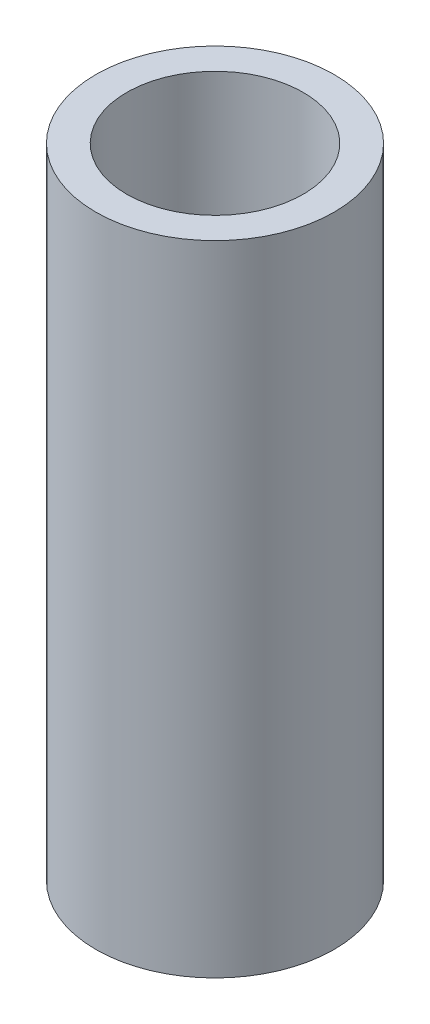
from build123d import *

# Parameters (mm, degrees)
SCHEDULE40TUBE_R           = 10.668
SCHEDULE40TUBE_R_2         = 7.8994
SCHEDULE40TUBELENGTH_DEPTH = 57.15


with BuildPart() as part:
    # Schedule40Tube → Schedule40TubeLength (new body)
    with BuildSketch(Plane(origin=(0, 0, 0), x_dir=(1, 0, 0), z_dir=(0, 1, 0))):
        with Locations(Location((0, 0, 0), (0, 0, 270))):
            Circle(SCHEDULE40TUBE_R)
        with Locations(Location((0, 0, 0), (0, 0, 270))):
            Circle(SCHEDULE40TUBE_R_2, mode=Mode.SUBTRACT)
    extrude(amount=SCHEDULE40TUBELENGTH_DEPTH)


solid = part.part
